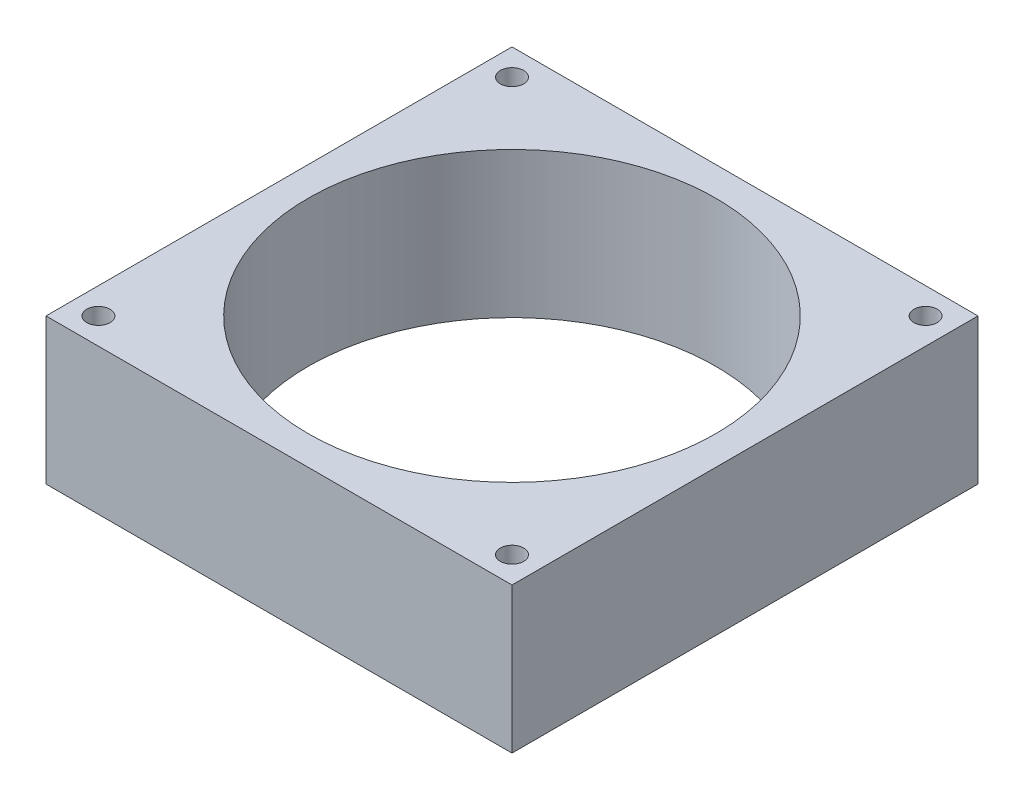
from build123d import *

# Parameters (mm, degrees)
SKETCH1_W           = 80
SKETCH1_H           = 80
SKETCH1_R           = 2
SKETCH1_R_2         = 35
BOSS_EXTRUDE1_DEPTH = 25


with BuildPart() as part:
    # Sketch1 → Boss-Extrude1 (new body)
    with BuildSketch(Plane(origin=(0, 0, 0), x_dir=(1, 0, 0), z_dir=(0, 1, 0))):
        Rectangle(SKETCH1_W, SKETCH1_H)
        with Locations(Location((-35.5, 35.5, 0), (0, 0, 270))):
            Circle(SKETCH1_R, mode=Mode.SUBTRACT)
        with Locations(Location((35.5, 35.5, 0), (0, 0, 270))):
            Circle(SKETCH1_R, mode=Mode.SUBTRACT)
        with Locations(Location((35.5, -35.5, 0), (0, 0, 270))):
            Circle(SKETCH1_R, mode=Mode.SUBTRACT)
        with Locations(Location((-35.5, -35.5, 0), (0, 0, 270))):
            Circle(SKETCH1_R, mode=Mode.SUBTRACT)
        with Locations(Location((0, 0, 0), (0, 0, 270))):
            Circle(SKETCH1_R_2, mode=Mode.SUBTRACT)
    extrude(amount=BOSS_EXTRUDE1_DEPTH)


solid = part.part
